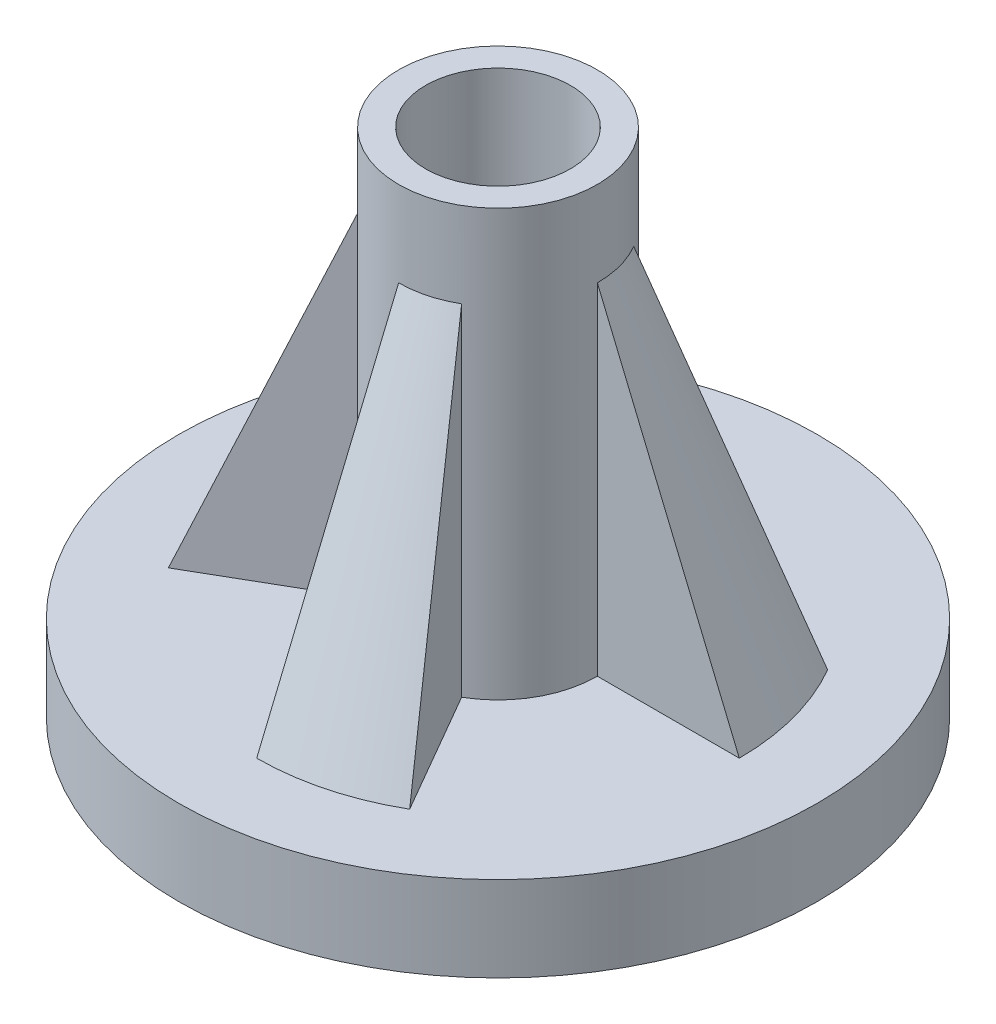
from build123d import *

# Parameters (mm, degrees)
SKETCH_1_R          = 10.4
EXTRUDE_1_DEPTH     = 1.8
SKETCH_2_R          = 11.25
EXTRUDE_2_DEPTH     = 3
SKETCH_3_R          = 3.5
SKETCH_3_R_2        = 2.55
EXTRUDE_3_DEPTH     = 15
SKETCH_3_4_R        = 1.5
CUT_EXTRUDE_2_DEPTH = 4.8
REVOLVE_3_ANGLE     = 30
REVOLVE_4_ANGLE     = 30
EXTRUDE_4_DEPTH     = 2
SKETCH_14_W         = 11.25
SKETCH_14_H         = 3.8


with BuildPart() as part:
    # 草图1 → 凸台-拉伸1 (new body)
    with BuildSketch(Plane(origin=(0, 0, 0), x_dir=(1, 0, 0), z_dir=(0, 1, 0))):
        with Locations(Location((0, 0, 0), (0, 0, 270))):
            Circle(SKETCH_1_R)
    extrude(amount=EXTRUDE_1_DEPTH)

    # 草图2 → 凸台-拉伸2 (add)
    with BuildSketch(Plane(origin=(0, 1.8, 0), x_dir=(1, 0, 0), z_dir=(0, 1, 0))):
        with Locations(Location((0, 0, 0), (0, 0, 270))):
            Circle(SKETCH_2_R)
    extrude(amount=EXTRUDE_2_DEPTH)

    # 草图3 → 凸台-拉伸3 (add)
    with BuildSketch(Plane(origin=(0, 4.8, 0), x_dir=(1, 0, 0), z_dir=(0, 1, 0))):
        with Locations(Location((0, 0, 0), (0, 0, 270))):
            Circle(SKETCH_3_R)
        with Locations(Location((0, 0, 0), (0, 0, 270))):
            Circle(SKETCH_3_R_2, mode=Mode.SUBTRACT)
    extrude(amount=EXTRUDE_3_DEPTH)

    # 草图3<4> → 切除-拉伸2 (cut)
    with BuildSketch(Plane(origin=(0, 4.8, 0), x_dir=(1, 0, 0), z_dir=(0, 1, 0))):
        with Locations(Location((0, 0, 0), (0, 0, 270))):
            Circle(SKETCH_3_4_R)
    extrude(amount=-CUT_EXTRUDE_2_DEPTH, mode=Mode.SUBTRACT)

    # 草图6 → 旋转3 (revolve)
    with BuildSketch(Plane(origin=(0, 0, 0), x_dir=(0, 0, -1), z_dir=(1, 0, 0))):
        Polygon((3.5, 4.8), (3.5, 16.8), (8.5, 4.8), align=None)
        Polygon((-8.5, 4.8), (-3.5, 4.8), (-3.5, 16.8), align=None)
    revolve(axis=Axis((0, 0, 0), (0, 1, 0)), revolution_arc=REVOLVE_3_ANGLE)

    # 草图9 → 旋转4 (revolve)
    with BuildSketch(Plane.XY):
        Polygon((3.5, 4.8), (8.5, 4.8), (3.5, 16.8), align=None)
        Polygon((-8.5, 4.8), (-3.5, 16.8), (-3.5, 4.8), align=None)
    revolve(axis=Axis((0, 0, 0), (0, 1, 0)), revolution_arc=REVOLVE_4_ANGLE)

    # 草图10 → 凸台-拉伸4 (add)
    with BuildSketch(Plane.XZ):
        with BuildLine():
            Line((9.961946981, -0.871557427), (10.858522209, -0.949997596))
            ThreePointArc((10.858522209, -0.949997596), (10.9, 0), (10.858522209, 0.949997596))
            Line((10.858522209, 0.949997596), (9.961946981, 0.871557427))
            ThreePointArc((9.961946981, 0.871557427), (9.84807753, 1.736481777), (9.659258263, 2.588190451))
            Line((9.659258263, 2.588190451), (8.693332437, 2.329371406))
            ThreePointArc((8.693332437, 2.329371406), (9, 0), (8.693332437, -2.329371406))
            Line((8.693332437, -2.329371406), (9.659258263, -2.588190451))
            ThreePointArc((9.659258263, -2.588190451), (9.84807753, -1.736481777), (9.961946981, -0.871557427))
        make_face()
        with BuildLine():
            Line((2.329371406, 8.693332437), (2.588190451, 9.659258263))
            ThreePointArc((2.588190451, 9.659258263), (1.736481777, 9.84807753), (0.871557427, 9.961946981))
            Line((0.871557427, 9.961946981), (0.949997596, 10.858522209))
            ThreePointArc((0.949997596, 10.858522209), (0, 10.9), (-0.949997596, 10.858522209))
            Line((-0.949997596, 10.858522209), (-0.871557427, 9.961946981))
            ThreePointArc((-0.871557427, 9.961946981), (-1.736481777, 9.84807753), (-2.588190451, 9.659258263))
            Line((-2.588190451, 9.659258263), (-2.329371406, 8.693332437))
            ThreePointArc((-2.329371406, 8.693332437), (0, 9), (2.329371406, 8.693332437))
        make_face()
        with BuildLine():
            Line((-2.329371406, -8.693332437), (-2.588190451, -9.659258263))
            ThreePointArc((-2.588190451, -9.659258263), (-1.736481777, -9.84807753), (-0.871557427, -9.961946981))
            Line((-0.871557427, -9.961946981), (-0.949997596, -10.858522209))
            ThreePointArc((-0.949997596, -10.858522209), (0, -10.9), (0.949997596, -10.858522209))
            Line((0.949997596, -10.858522209), (0.871557427, -9.961946981))
            ThreePointArc((0.871557427, -9.961946981), (1.736481777, -9.84807753), (2.588190451, -9.659258263))
            Line((2.588190451, -9.659258263), (2.329371406, -8.693332437))
            ThreePointArc((2.329371406, -8.693332437), (0, -9), (-2.329371406, -8.693332437))
        make_face()
        with BuildLine():
            Line((-8.693332437, 2.329371406), (-9.659258263, 2.588190451))
            ThreePointArc((-9.659258263, 2.588190451), (-9.84807753, 1.736481777), (-9.961946981, 0.871557427))
            Line((-9.961946981, 0.871557427), (-10.858522209, 0.949997596))
            ThreePointArc((-10.858522209, 0.949997596), (-10.9, 0), (-10.858522209, -0.949997596))
            Line((-10.858522209, -0.949997596), (-9.961946981, -0.871557427))
            ThreePointArc((-9.961946981, -0.871557427), (-9.84807753, -1.736481777), (-9.659258263, -2.588190451))
            Line((-9.659258263, -2.588190451), (-8.693332437, -2.329371406))
            ThreePointArc((-8.693332437, -2.329371406), (-9, 0), (-8.693332437, 2.329371406))
        make_face()
    extrude(amount=EXTRUDE_4_DEPTH)

    # 草图11 → 切除-旋转2 (revolve, cut)
    with BuildSketch(Plane.XY, mode=Mode.PRIVATE) as cut_revolve_2_sk:
        Polygon((9.961946981, -2), (10.9, -2), (10.9, 0), align=None)
    revolve(cut_revolve_2_sk.sketch.rotate(Axis((0, 0, 0), (0, -1, 0)), 275), axis=Axis((0, 0, 0), (0, -1, 0)), mode=Mode.SUBTRACT)

    # 草图14 → 切除-旋转3 (revolve, cut)
    with BuildSketch(Plane(origin=(0, 0, 0), x_dir=(0, 0, -1), z_dir=(1, 0, 0))):
        with Locations((-5.625, -0.1)):
            Rectangle(SKETCH_14_W, SKETCH_14_H)
    revolve(axis=Axis((0, 1.8, 0), (0, -1, 0)), mode=Mode.SUBTRACT)


solid = part.part
